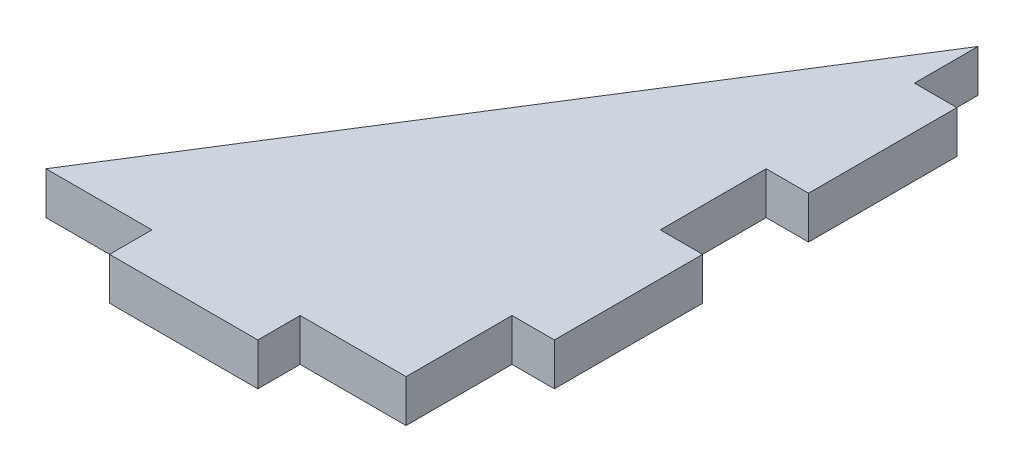
from build123d import *

# Parameters (mm, degrees)
SKETCH1_W           = 7
SKETCH1_H           = 2
SKETCH1_W_2         = 2
SKETCH1_H_2         = 7
BOSS_EXTRUDE1_DEPTH = 2


with BuildPart() as part:
    # Sketch1 → Boss-Extrude1 (new body)
    with BuildSketch(Plane(origin=(0, 0, 0), x_dir=(1, 0, 0), z_dir=(0, 1, 0))):
        Polygon((0, 27), (0, 0), (-17, 0), align=None)
        with Locations((-8.5, -1)):
            Rectangle(SKETCH1_W, SKETCH1_H)
        with Locations((1, 8.5)):
            Rectangle(SKETCH1_W_2, SKETCH1_H_2)
        with Locations((1, 20.5)):
            Rectangle(SKETCH1_W_2, SKETCH1_H_2)
    extrude(amount=BOSS_EXTRUDE1_DEPTH)


solid = part.part
